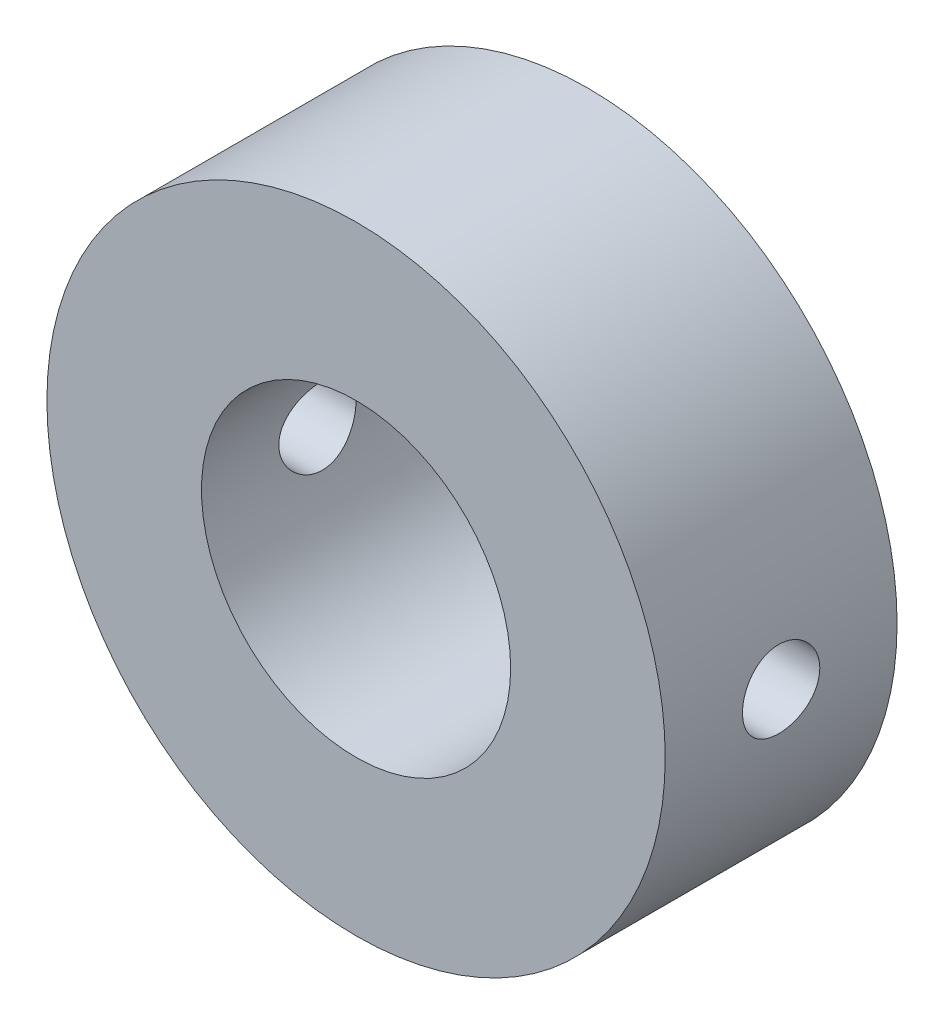
from build123d import *

# Parameters (mm, degrees)
SKETCH1_R                = 8
SKETCH1_R_2              = 4
BOSS_EXTRUDE1_DEPTH      = 6
F_2_0_2_DIAMETER_HOLE1_D = 2


with BuildPart() as part:
    # Sketch1 → Boss-Extrude1 (new body)
    with BuildSketch(Plane.XY):
        Circle(SKETCH1_R)
        Circle(SKETCH1_R_2, mode=Mode.SUBTRACT)
    extrude(amount=BOSS_EXTRUDE1_DEPTH)

    # Ø2.0 (2) Diameter Hole1 (through all)
    with Locations(Plane(origin=(8, 0, 3), x_dir=(0, 1, 0), z_dir=(1, 0, 0))):
        with Locations((0, 0)):
            Hole(F_2_0_2_DIAMETER_HOLE1_D / 2)


solid = part.part
